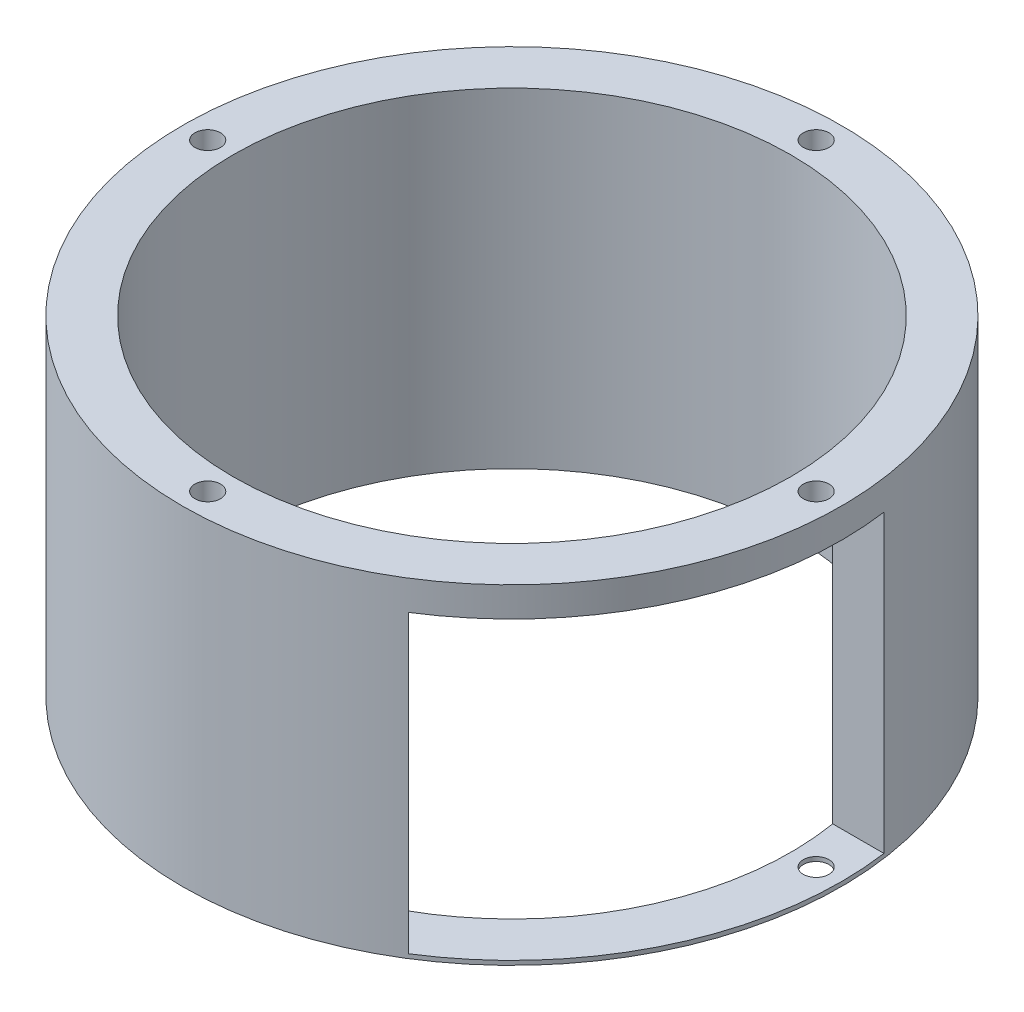
from build123d import *

# Parameters (mm, degrees)
SKETCH1_R           = 65
SKETCH1_R_2         = 2.525
SKETCH1_R_3         = 55
BOSS_EXTRUDE1_DEPTH = 65
SKETCH2_R           = 9.525
CUT_EXTRUDE1_DEPTH  = 113.583302492
SKETCH3_W           = 64
SKETCH3_H           = 58.3
CUT_EXTRUDE2_DEPTH  = 113.583302665


with BuildPart() as part:
    # Sketch1 → Boss-Extrude1 (new body)
    with BuildSketch(Plane(origin=(0, 0, 0), x_dir=(1, 0, 0), z_dir=(0, 1, 0))):
        with Locations(Location((0, 0, 0), (0, 0, 270))):
            Circle(SKETCH1_R)
        with Locations(Location((0, 60, 0), (0, 0, 270))):
            Circle(SKETCH1_R_2, mode=Mode.SUBTRACT)
        with Locations(Location((60, 0, 0), (0, 0, 270))):
            Circle(SKETCH1_R_2, mode=Mode.SUBTRACT)
        with Locations(Location((0, -60, 0), (0, 0, 270))):
            Circle(SKETCH1_R_2, mode=Mode.SUBTRACT)
        with Locations(Location((-60, 0, 0), (0, 0, 270))):
            Circle(SKETCH1_R_2, mode=Mode.SUBTRACT)
        with Locations(Location((0, 0, 0), (0, 0, 270))):
            Circle(SKETCH1_R_3, mode=Mode.SUBTRACT)
    extrude(amount=BOSS_EXTRUDE1_DEPTH)

    # Sketch2 → Cut-Extrude1 (cut, through all)
    with BuildSketch(Plane(origin=(0, 0, 0), x_dir=(0, 0, -1), z_dir=(1, 0, 0))):
        with Locations(Location((-24.25, 30, 0), (0, 0, 180))):
            Circle(SKETCH2_R)
    extrude(amount=CUT_EXTRUDE1_DEPTH, mode=Mode.SUBTRACT)

    # Sketch3 → Cut-Extrude2 (cut, through all)
    with BuildSketch(Plane(origin=(0, 0, 0), x_dir=(0, 0, -1), z_dir=(1, 0, 0))):
        with Locations((-23, 30)):
            Rectangle(SKETCH3_W, SKETCH3_H)
        with BuildLine():
            Line((-41.625, 43.85), (-41.625, 53.85))
            ThreePointArc((-41.625, 53.85), (-44.875, 57.1), (-48.125, 53.85))
            Line((-48.125, 53.85), (-48.125, 43.85))
            ThreePointArc((-48.125, 43.85), (-44.875, 40.6), (-41.625, 43.85))
        make_face(mode=Mode.SUBTRACT)
        with BuildLine():
            Line((2.125, 43.85), (2.125, 53.85))
            ThreePointArc((2.125, 53.85), (-1.125, 57.1), (-4.375, 53.85))
            Line((-4.375, 53.85), (-4.375, 43.85))
            ThreePointArc((-4.375, 43.85), (-1.125, 40.6), (2.125, 43.85))
        make_face(mode=Mode.SUBTRACT)
    extrude(amount=CUT_EXTRUDE2_DEPTH, mode=Mode.SUBTRACT)


with BuildPart() as cut_extrude2_kept_piece:
    # of the separate pieces the step leaves, the one the design keeps (cut_extrude2_pieces_kept)
    add(part.part.solids().sort_by_distance((0, 0, 65))[0])


solid = cut_extrude2_kept_piece.part
